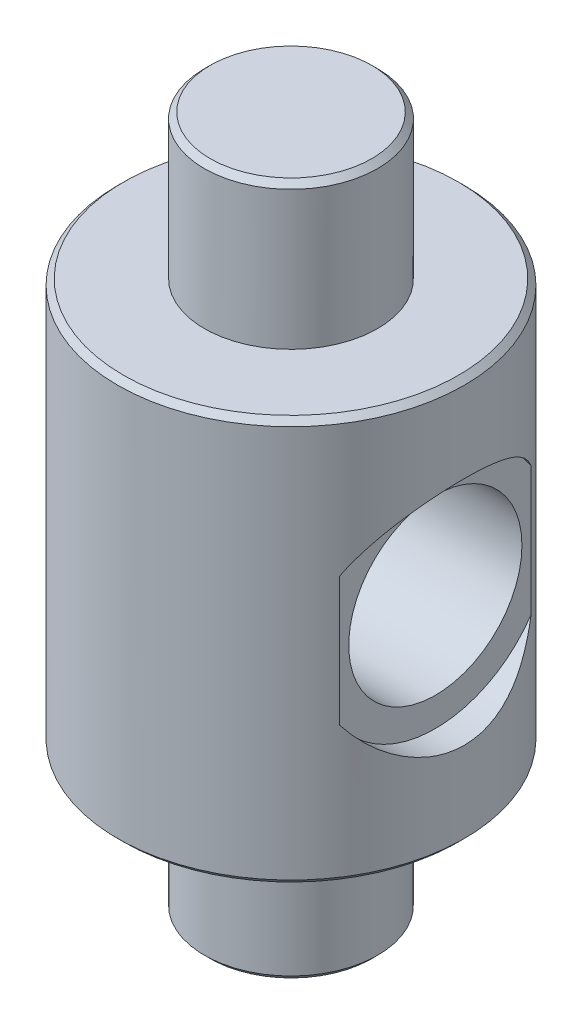
from build123d import *

# Parameters (mm, degrees)
SKETCH6_R          = 2
CUT_EXTRUDE1_DEPTH = 0.5
SKETCH7_R          = 1.5
CUT_EXTRUDE2_DEPTH = 14.536986433
CHAMFER1_SIZE      = 0.1


with BuildPart() as part:
    # Sketch1 → Revolve1 (revolve)
    with BuildSketch(Plane.XY, mode=Mode.PRIVATE) as revolve1_sk:
        Polygon((0, 0), (0, 12), (1.5, 12), (1.5, 9.5), (3, 9.5), (3, 2.5), (1.5, 2.5), (1.5, 0), align=None)
    revolve(revolve1_sk.sketch.rotate(Axis((0, 0, 0), (0, 1, 0)), 90), axis=Axis((0, 0, 0), (0, 1, 0)))

    # Sketch6 → Cut-Extrude1 (cut)
    with BuildSketch(Plane(origin=(3, 0, 0), x_dir=(0, 0, -1), z_dir=(1, 0, 0))):
        with Locations((0, 6)):
            Circle(SKETCH6_R)
    cut_extrude1 = extrude(amount=-CUT_EXTRUDE1_DEPTH, mode=Mode.SUBTRACT)

    # Mirror1: Cut-Extrude1 across plane
    add(cut_extrude1.mirror(Plane(origin=(0, 0, 0), x_dir=(0, 0, 1), z_dir=(1, 0, 0))), mode=Mode.SUBTRACT)

    # Sketch7 → Cut-Extrude2 (cut, through all)
    with BuildSketch(Plane(origin=(2.5, 0, 0), x_dir=(0, 0, -1), z_dir=(1, 0, 0))):
        with Locations((0, 6)):
            Circle(SKETCH7_R)
    extrude(amount=-CUT_EXTRUDE2_DEPTH, mode=Mode.SUBTRACT)

    # Chamfer1
    chamfer1_edges = [part.edges().sort_by_distance(p)[0] for p in [
        (0, 0, 1.5),
        (0, 2.5, 3),
        (0, 9.5, 3),
        (0, 12, 1.5),
    ]]
    chamfer(chamfer1_edges, length=CHAMFER1_SIZE)


solid = part.part
